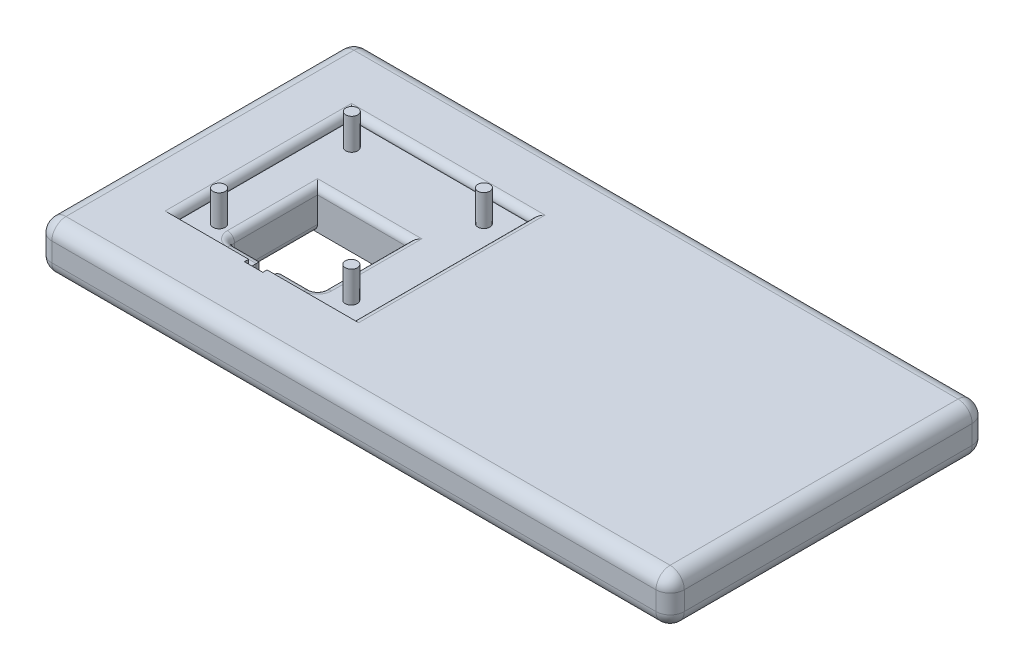
from build123d import *

# Parameters (mm, degrees)
SKETCH1_W           = 134
SKETCH1_H           = 67
BOSS_EXTRUDE1_DEPTH = 10
SKETCH2_W           = 19.1
SKETCH2_H           = 19.1
CUT_EXTRUDE1_DEPTH  = 10
SKETCH2_3_R         = 1.275
BOSS_EXTRUDE2_DEPTH = 5
CUT_EXTRUDE3_START  = -1.6
SKETCH2_6_R         = 1.275
CUT_EXTRUDE3_DEPTH  = 1.6
SKETCH2_5_W         = 3.9
SKETCH2_5_H         = 3.1
SKETCH2_5_H_2       = 0.9
CUT_EXTRUDE2_DEPTH  = 3.14
FILLET1_R           = 3
FILLET2_R           = 1.5
FILLET3_R           = 1.5


with BuildPart() as part:
    # Sketch1 → Boss-Extrude1 (new body)
    with BuildSketch(Plane(origin=(0, 0, 0), x_dir=(1, 0, 0), z_dir=(0, 1, 0))):
        with Locations((41.212068984, -10.4030388)):
            Rectangle(SKETCH1_W, SKETCH1_H)
    extrude(amount=BOSS_EXTRUDE1_DEPTH)

    # Sketch2 → Cut-Extrude1 (cut)
    with BuildSketch(Plane(origin=(0, 10, 0), x_dir=(1, 0, 0), z_dir=(0, 1, 0))):
        with Locations((6.362068984, -16.7530388)):
            Rectangle(SKETCH2_W, SKETCH2_H)
    extrude(amount=-CUT_EXTRUDE1_DEPTH, mode=Mode.SUBTRACT)

    # Sketch2<3> → Boss-Extrude2 (add)
    with BuildSketch(Plane(origin=(0, 10, 0), x_dir=(1, 0, 0), z_dir=(0, 1, 0))):
        with Locations(Location((-6.787931016, 3.6469612, 0), (0, 0, 270))):
            Circle(SKETCH2_3_R)
        with Locations(Location((-6.787931016, -24.4530388, 0), (0, 0, 270))):
            Circle(SKETCH2_3_R)
        with Locations(Location((21.212068984, -24.4530388, 0), (0, 0, 270))):
            Circle(SKETCH2_3_R)
        with Locations(Location((21.212068984, 3.6469612, 0), (0, 0, 270))):
            Circle(SKETCH2_3_R)
    extrude(amount=BOSS_EXTRUDE2_DEPTH)

    # Sketch2<6> → Cut-Extrude3 (cut)
    with BuildSketch(Plane(origin=(0, 10, 0), x_dir=(1, 0, 0), z_dir=(0, 1, 0)).offset(CUT_EXTRUDE3_START)):
        Polygon((26.212068984, 8.5969612), (-11.787931016, 8.5969612), (-11.787931016, -29.4030388), (4.412068984, -29.4030388), (4.412068984, -26.3030388), (-3.187931016, -26.3030388), (-3.187931016, -7.2030388), (15.912068984, -7.2030388), (15.912068984, -26.3030388), (8.312068984, -26.3030388), (8.312068984, -29.4030388), (26.212068984, -29.4030388), align=None)
        with Locations(Location((-6.787931016, -24.4530388, 0), (0, 0, 270))):
            Circle(SKETCH2_6_R, mode=Mode.SUBTRACT)
        with Locations(Location((21.212068984, -24.4530388, 0), (0, 0, 270))):
            Circle(SKETCH2_6_R, mode=Mode.SUBTRACT)
        with Locations(Location((-6.787931016, 3.6469612, 0), (0, 0, 270))):
            Circle(SKETCH2_6_R, mode=Mode.SUBTRACT)
        with Locations(Location((21.212068984, 3.6469612, 0), (0, 0, 270))):
            Circle(SKETCH2_6_R, mode=Mode.SUBTRACT)
    extrude(amount=CUT_EXTRUDE3_DEPTH, mode=Mode.SUBTRACT)

    # Sketch2<5> → Cut-Extrude2 (cut)
    with BuildSketch(Plane(origin=(0, 10, 0), x_dir=(1, 0, 0), z_dir=(0, 1, 0))):
        with Locations((6.362068984, -27.8530388)):
            Rectangle(SKETCH2_5_W, SKETCH2_5_H)
        with Locations((6.362068984, -29.8530388)):
            Rectangle(SKETCH2_5_W, SKETCH2_5_H_2)
    extrude(amount=-CUT_EXTRUDE2_DEPTH, mode=Mode.SUBTRACT)

    # Fillet1
    fillet1_edges = [part.edges().sort_by_distance(p)[0] for p in [
        (108.212068984, 10, 10.4030388),
        (41.212068984, 10, -23.0969612),
        (-25.787931016, 10, 10.4030388),
        (41.212068984, 0, -23.0969612),
        (108.212068984, 0, 10.4030388),
        (41.212068984, 0, 43.9030388),
        (-25.787931016, 0, 10.4030388),
        (-25.787931016, 5, -23.0969612),
        (108.212068984, 5, -23.0969612),
        (108.212068984, 5, 43.9030388),
        (-25.787931016, 5, 43.9030388),
        (41.212068984, 10, 43.9030388),
    ]]
    fillet(fillet1_edges, radius=FILLET1_R)

    # Fillet2
    fillet2_edges = [part.edges().sort_by_distance(p)[0] for p in [
        (4.412068984, 7.63, 26.3030388),
        (6.362068984, 6.86, 26.3030388),
        (-3.187931016, 4.2, 26.3030388),
        (15.912068984, 4.2, 26.3030388),
        (15.912068984, 0, 16.7530388),
        (6.362068984, 0, 26.3030388),
        (-3.187931016, 0, 16.7530388),
        (15.912068984, 8.4, 16.7530388),
        (6.362068984, 8.4, 7.2030388),
        (12.112068984, 8.4, 26.3030388),
        (-3.187931016, 8.4, 16.7530388),
        (0.612068984, 8.4, 26.3030388),
        (8.312068984, 7.63, 26.3030388),
    ]]
    fillet(fillet2_edges, radius=FILLET2_R)

    # Fillet3
    fillet3_edges = [part.edges().sort_by_distance(p)[0] for p in [
        (7.212068984, 10, -8.5969612),
        (26.212068984, 10, 10.4030388),
        (-11.787931016, 10, 10.4030388),
    ]]
    fillet(fillet3_edges, radius=FILLET3_R)


solid = part.part
